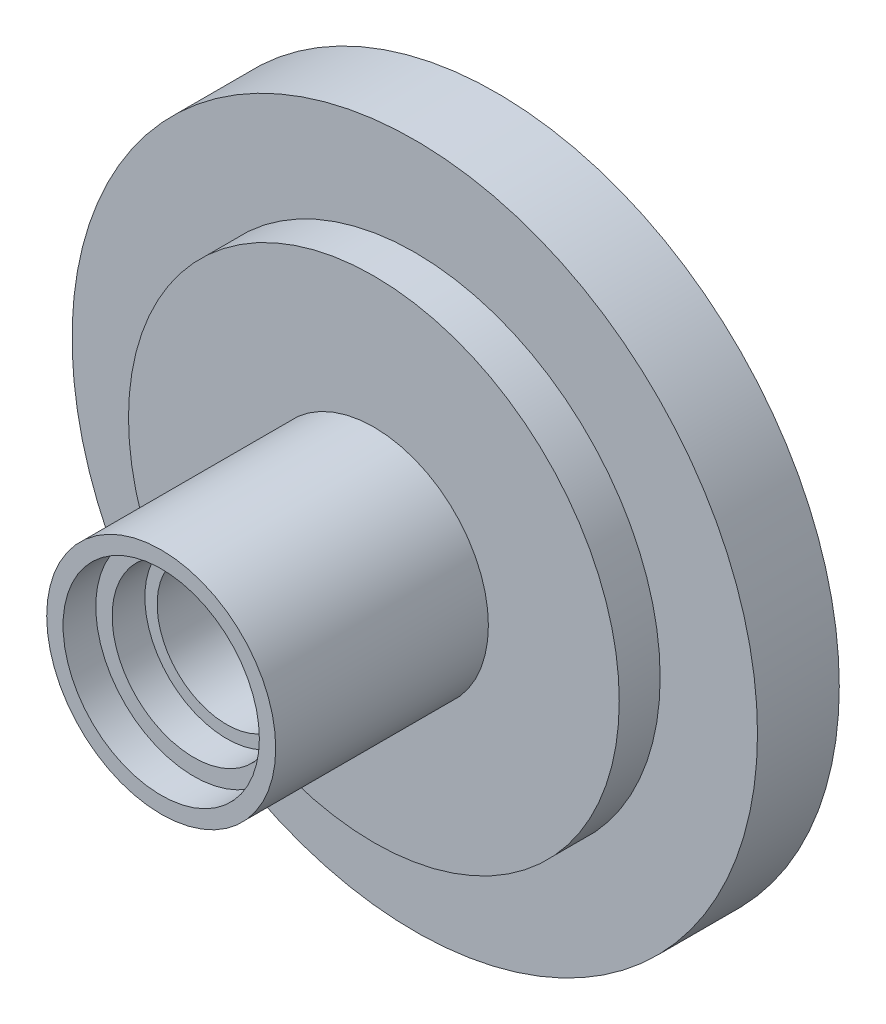
from build123d import *


with BuildPart() as part:
    # Sketch1 → Revolve1 (revolve)
    with BuildSketch(Plane(origin=(0, 0, 0), x_dir=(0, 0, -1), z_dir=(1, 0, 0)), mode=Mode.PRIVATE) as revolve1_sk:
        Polygon((0, 6), (0, 7), (13, 7), (13, 15), (15.5, 15), (15.5, 20.95), (20.5, 20.95), (20.5, 7), (28, 7), (28, 6), (26, 6), (26, 5), (24, 5), (24, 4.25), (4, 4.25), (4, 5), (2, 5), (2, 6), align=None)
    revolve(revolve1_sk.sketch.rotate(Axis((0, 0, 0), (0, 0, -1)), 90), axis=Axis((0, 0, 0), (0, 0, -1)))


solid = part.part
